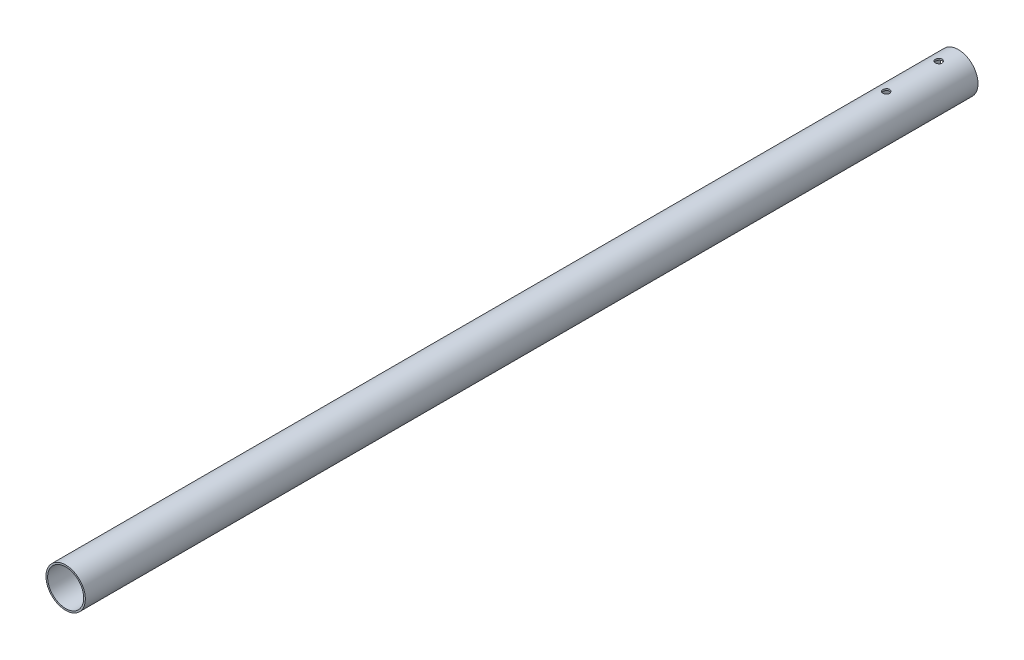
from build123d import *

# Parameters (mm, degrees)
CROQUIS1_R                 = 19.05
CROQUIS1_R_2               = 17.4625
SALIENTE_EXTRUIR1_DEPTH    = 863.6
CORTAR_EXTRUIR1_DEPTH      = 865.0201184
CORTAR_EXTRUIR1_DEPTH_BACK = 865.0201184
CROQUIS2_R                 = 3.2639


with BuildPart() as part:
    # Croquis1 → Saliente-Extruir1 (new body)
    with BuildSketch(Plane.XY):
        Circle(CROQUIS1_R)
        Circle(CROQUIS1_R_2, mode=Mode.SUBTRACT)
    extrude(amount=SALIENTE_EXTRUIR1_DEPTH)

    # Croquis2 → Cortar-Extruir1 (cut, two sides: drawn at the far end of the back side and taken through both)
    with BuildSketch(Plane(origin=(0, 0, 0), x_dir=(1, 0, 0), z_dir=(0, 1, 0)).offset(-CORTAR_EXTRUIR1_DEPTH_BACK)):
        with Locations(Location((0, -19.05, 0), (0, 0, 270))):
            Circle(CROQUIS2_R)
        with Locations(Location((0, -69.85, 0), (0, 0, 270))):
            Circle(CROQUIS2_R)
    extrude(amount=CORTAR_EXTRUIR1_DEPTH + CORTAR_EXTRUIR1_DEPTH_BACK, mode=Mode.SUBTRACT)


solid = part.part
